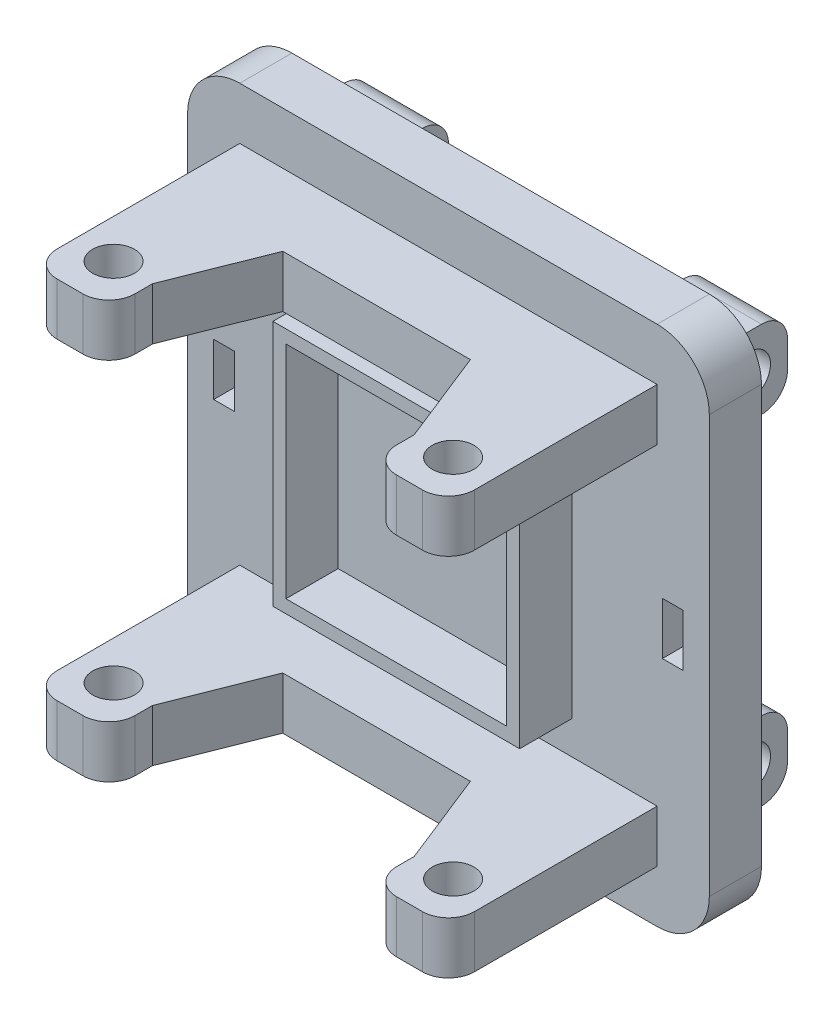
from build123d import *

# Parameters (mm, degrees)
SCHIZZO1_W                   = 100
SCHIZZO1_H                   = 100
ESTRUSIONE_ESTRUSIONE1_DEPTH = 10
RACCORDO1_R                  = 10
SCHIZZO6_W                   = 15
SCHIZZO6_H                   = 15
ESTRUSIONE_ESTRUSIONE2_DEPTH = 15
RACCORDO2_R                  = 5
SCHIZZO7_R                   = 4
TAGLIO_ESTRUSIONE1_DEPTH     = 15
RACCORDO3_R                  = 5
SPECCHIA6_COPY_1_SKETCH_W    = 15
SPECCHIA6_COPY_1_SKETCH_H    = 15
SPECCHIA6_COPY_1_DEPTH       = 15
SPECCHIA6_COPY_2_SKETCH_R    = 4
SPECCHIA6_COPY_2_DEPTH       = 15
SPECCHIA6_COPY_3_SKETCH_W    = 15
SPECCHIA6_COPY_3_SKETCH_H    = 15
SPECCHIA6_COPY_3_DEPTH       = 15
SPECCHIA6_COPY_4_SKETCH_R    = 4
SPECCHIA6_COPY_4_DEPTH       = 15
RACCORDO3_OF_SPECCHIA6_R     = 5
RACCORDO4_R                  = 5
SCHIZZO8_W                   = 47.3
SCHIZZO8_H                   = 47.3
SCHIZZO8_W_2                 = 42.3
SCHIZZO8_H_2                 = 42.3
ESTRUSIONE_ESTRUSIONE4_DEPTH = 10
SCHIZZO10_W                  = 80
SCHIZZO10_H                  = 10
ESTRUSIONE_ESTRUSIONE6_DEPTH = 40
SCHIZZO11_R                  = 4
TAGLIO_ESTRUSIONE4_DEPTH     = 30
SCHIZZO11_4_R                = 4
TAGLIO_ESTRUSIONE5_DEPTH     = 30
RACCORDO5_R                  = 5
RACCORDO6_R                  = 5
TAGLIO_ESTRUSIONE6_DEPTH     = 30
RACCORDO7_R                  = 5
RACCORDO8_R                  = 5
RACCORDO9_R                  = 5
SCHIZZO15_R                  = 4
TAGLIO_ESTRUSIONE7_DEPTH     = 30
SCHIZZO15_3_R                = 4
TAGLIO_ESTRUSIONE8_DEPTH     = 30
SCHIZZO16_W                  = 4
SCHIZZO16_H                  = 10
TAGLIO_ESTRUSIONE11_DEPTH    = 10


with BuildPart() as part:
    # Schizzo1 → Estrusione-Estrusione1 (new body)
    with BuildSketch(Plane.XY):
        Rectangle(SCHIZZO1_W, SCHIZZO1_H)
    extrude(amount=ESTRUSIONE_ESTRUSIONE1_DEPTH)

    # Raccordo1
    raccordo1_edges = [part.edges().sort_by_distance(p)[0] for p in [
        (50, -50, 5),
        (-50, -50, 5),
        (50, 50, 5),
        (-50, 50, 5),
    ]]
    fillet(raccordo1_edges, radius=RACCORDO1_R)

    # Schizzo6 → Estrusione-Estrusione2 (add)
    with BuildSketch(Plane(origin=(0, 0, 0), x_dir=(-1, 0, 0), z_dir=(0, 0, -1))):
        with Locations((-32.5, 32.5)):
            Rectangle(SCHIZZO6_W, SCHIZZO6_H)
    estrusione_estrusione2 = extrude(amount=ESTRUSIONE_ESTRUSIONE2_DEPTH)

    # Raccordo2
    raccordo2_edges = [part.edges().sort_by_distance(p)[0] for p in [
        (32.5, 25, -15),
        (32.5, 40, -15),
    ]]
    fillet(raccordo2_edges, radius=RACCORDO2_R)

    # Schizzo7 → Taglio-Estrusione1 (cut)
    with BuildSketch(Plane(origin=(40, 0, 0), x_dir=(0, 0, -1), z_dir=(1, 0, 0))):
        with Locations((7.72654806, 32.54210957)):
            Circle(SCHIZZO7_R)
    taglio_estrusione1 = extrude(amount=-TAGLIO_ESTRUSIONE1_DEPTH, mode=Mode.SUBTRACT)

    # Specchia3: Estrusione-Estrusione2, Taglio-Estrusione1 across plane
    add(estrusione_estrusione2.mirror(Plane(origin=(0, 0, 0), x_dir=(0, 0, 1), z_dir=(1, 0, 0))))
    add(taglio_estrusione1.mirror(Plane(origin=(0, 0, 0), x_dir=(0, 0, 1), z_dir=(1, 0, 0))), mode=Mode.SUBTRACT)

    # Raccordo3
    raccordo3_edges = [part.edges().sort_by_distance(p)[0] for p in [
        (-32.5, 25, -15),
        (-32.5, 40, -15),
    ]]
    fillet(raccordo3_edges, radius=RACCORDO3_R)

    # Specchia6 copy 1 sketch → Specchia6 copy 1 (add)
    with BuildSketch(Plane(origin=(0, 0, 0), x_dir=(1, 0, 0), z_dir=(0, 0, -1))):
        with Locations((-32.5, 32.5)):
            Rectangle(SPECCHIA6_COPY_1_SKETCH_W, SPECCHIA6_COPY_1_SKETCH_H)
    extrude(amount=SPECCHIA6_COPY_1_DEPTH)

    # Specchia6 copy 2 sketch → Specchia6 copy 2 (cut)
    with BuildSketch(Plane(origin=(-40, 0, 0), x_dir=(0, 0, -1), z_dir=(-1, 0, 0))):
        with Locations((7.72654806, 32.54210957)):
            Circle(SPECCHIA6_COPY_2_SKETCH_R)
    extrude(amount=-SPECCHIA6_COPY_2_DEPTH, mode=Mode.SUBTRACT)

    # Specchia6 copy 3 sketch → Specchia6 copy 3 (add)
    with BuildSketch(Plane(origin=(0, 0, 0), x_dir=(-1, 0, 0), z_dir=(0, 0, -1))):
        with Locations((-32.5, -32.5)):
            Rectangle(SPECCHIA6_COPY_3_SKETCH_W, SPECCHIA6_COPY_3_SKETCH_H)
    extrude(amount=SPECCHIA6_COPY_3_DEPTH)

    # Specchia6 copy 4 sketch → Specchia6 copy 4 (cut)
    with BuildSketch(Plane(origin=(40, 0, 0), x_dir=(0, 0, -1), z_dir=(1, 0, 0))):
        with Locations((7.72654806, -32.54210957)):
            Circle(SPECCHIA6_COPY_4_SKETCH_R)
    extrude(amount=-SPECCHIA6_COPY_4_DEPTH, mode=Mode.SUBTRACT)

    # Raccordo3 of Specchia6
    raccordo3_of_specchia6_edges = [part.edges().sort_by_distance(p)[0] for p in [
        (-32.5, -25, -15),
        (-32.5, -40, -15),
    ]]
    fillet(raccordo3_of_specchia6_edges, radius=RACCORDO3_OF_SPECCHIA6_R)

    # Raccordo4
    raccordo4_edges = [part.edges().sort_by_distance(p)[0] for p in [
        (32.5, -40, -15),
        (32.5, -25, -15),
    ]]
    fillet(raccordo4_edges, radius=RACCORDO4_R)

    # Schizzo8 → Estrusione-Estrusione4 (add)
    with BuildSketch(Plane.XY.offset(10)):
        Rectangle(SCHIZZO8_W, SCHIZZO8_H)
        Rectangle(SCHIZZO8_W_2, SCHIZZO8_H_2, mode=Mode.SUBTRACT)
    extrude(amount=ESTRUSIONE_ESTRUSIONE4_DEPTH)

    # Schizzo10 → Estrusione-Estrusione6 (add)
    with BuildSketch(Plane.XY.offset(10)):
        with Locations((0, -35)):
            Rectangle(SCHIZZO10_W, SCHIZZO10_H)
    estrusione_estrusione6 = extrude(amount=ESTRUSIONE_ESTRUSIONE6_DEPTH)

    # Schizzo11 → Taglio-Estrusione4 (cut)
    with BuildSketch(Plane.XZ.offset(40)):
        with Locations((32.539177419, 41.650021723)):
            Circle(SCHIZZO11_R)
    extrude(amount=-TAGLIO_ESTRUSIONE4_DEPTH, mode=Mode.SUBTRACT)

    # Schizzo11<4> → Taglio-Estrusione5 (cut)
    with BuildSketch(Plane.XZ.offset(40)):
        with Locations((-32.539177419, 41.650021723)):
            Circle(SCHIZZO11_4_R)
        with Locations((32.539177419, 41.650021723)):
            Circle(SCHIZZO11_4_R)
    extrude(amount=-TAGLIO_ESTRUSIONE5_DEPTH, mode=Mode.SUBTRACT)

    # Raccordo5
    raccordo5_edges = [part.edges().sort_by_distance(p)[0] for p in [
        (-40, -35, 50),
    ]]
    fillet(raccordo5_edges, radius=RACCORDO5_R)

    # Raccordo6
    raccordo6_edges = [part.edges().sort_by_distance(p)[0] for p in [
        (40, -35, 50),
    ]]
    fillet(raccordo6_edges, radius=RACCORDO6_R)

    # Schizzo14 → Taglio-Estrusione6 (cut)
    with BuildSketch(Plane.XZ.offset(40)):
        Polygon((-25.078354838, 41.650021723), (-25.078354838, 50), (25.078354838, 50), (25.078354838, 41.650021723), (17.979592653, 23.776203366), (-17.979592653, 23.776203366), align=None)
    taglio_estrusione6 = extrude(amount=-TAGLIO_ESTRUSIONE6_DEPTH, mode=Mode.SUBTRACT)

    # Raccordo7
    raccordo7_edges = [part.edges().sort_by_distance(p)[0] for p in [
        (-25.078354838, -35, 50),
    ]]
    fillet(raccordo7_edges, radius=RACCORDO7_R)

    # Raccordo8
    raccordo8_edges = [part.edges().sort_by_distance(p)[0] for p in [
        (25.078354838, -35, 50),
    ]]
    fillet(raccordo8_edges, radius=RACCORDO8_R)

    # Specchia13: Estrusione-Estrusione6 across plane
    add(estrusione_estrusione6.mirror(Plane.ZX))

    # Specchia14: Estrusione-Estrusione6, Taglio-Estrusione6 across plane
    add(estrusione_estrusione6.mirror(Plane.ZX))
    add(taglio_estrusione6.mirror(Plane.ZX), mode=Mode.SUBTRACT)

    # Raccordo9
    raccordo9_edges = [part.edges().sort_by_distance(p)[0] for p in [
        (-40, 35, 50),
        (-25.078354838, 35, 50),
        (40, 35, 50),
        (25.078354838, 35, 50),
    ]]
    fillet(raccordo9_edges, radius=RACCORDO9_R)

    # Schizzo15 → Taglio-Estrusione7 (cut)
    with BuildSketch(Plane(origin=(0, 40, 0), x_dir=(1, 0, 0), z_dir=(0, 1, 0))):
        with Locations((32.539177419, -41.65)):
            Circle(SCHIZZO15_R)
    extrude(amount=-TAGLIO_ESTRUSIONE7_DEPTH, mode=Mode.SUBTRACT)

    # Schizzo15<3> → Taglio-Estrusione8 (cut)
    with BuildSketch(Plane(origin=(0, 40, 0), x_dir=(1, 0, 0), z_dir=(0, 1, 0))):
        with Locations((32.539177419, -41.65)):
            Circle(SCHIZZO15_3_R)
        with Locations((-32.539177419, -41.65)):
            Circle(SCHIZZO15_3_R)
    extrude(amount=-TAGLIO_ESTRUSIONE8_DEPTH, mode=Mode.SUBTRACT)

    # Schizzo16 → Taglio-Estrusione11 (cut)
    with BuildSketch(Plane(origin=(0, 0, 0), x_dir=(-1, 0, 0), z_dir=(0, 0, -1))):
        with Locations((-43, 0)):
            Rectangle(SCHIZZO16_W, SCHIZZO16_H)
        with Locations((43, 0)):
            Rectangle(SCHIZZO16_W, SCHIZZO16_H)
    extrude(amount=-TAGLIO_ESTRUSIONE11_DEPTH, mode=Mode.SUBTRACT)


solid = part.part
